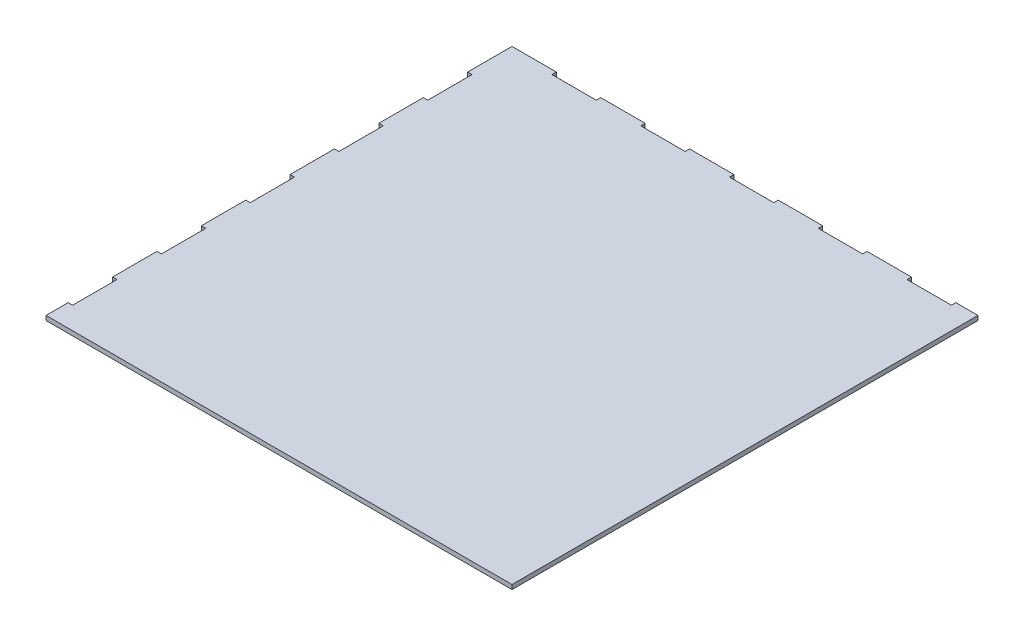
from build123d import *

# Parameters (mm, degrees)
SKETCH1_W               = 630
SKETCH1_H               = 630
BOSS_EXTRUDE1_DEPTH     = 3
SKETCH3_W               = 3
SKETCH3_H               = 30
CUT_EXTRUDE2_DEPTH      = 3
LPATTERN2_COUNT         = 10
LPATTERN2_PITCH         = 60
MIRROR1_COPY_1_SKETCH_W = 3
MIRROR1_COPY_1_SKETCH_H = 30
MIRROR1_COPY_1_DEPTH    = 3
MIRROR1_COPY_2_SKETCH_W = 3
MIRROR1_COPY_2_SKETCH_H = 30
MIRROR1_COPY_2_DEPTH    = 3
MIRROR1_COPY_3_SKETCH_W = 3
MIRROR1_COPY_3_SKETCH_H = 30
MIRROR1_COPY_3_DEPTH    = 3
MIRROR1_COPY_4_SKETCH_W = 3
MIRROR1_COPY_4_SKETCH_H = 30
MIRROR1_COPY_4_DEPTH    = 3
MIRROR1_COPY_5_SKETCH_W = 3
MIRROR1_COPY_5_SKETCH_H = 30
MIRROR1_COPY_5_DEPTH    = 3
MIRROR1_COPY_6_SKETCH_W = 3
MIRROR1_COPY_6_SKETCH_H = 30
MIRROR1_COPY_6_DEPTH    = 3
MIRROR1_COPY_7_SKETCH_W = 3
MIRROR1_COPY_7_SKETCH_H = 30
MIRROR1_COPY_7_DEPTH    = 3
MIRROR1_COPY_8_SKETCH_W = 3
MIRROR1_COPY_8_SKETCH_H = 30
MIRROR1_COPY_8_DEPTH    = 3
MIRROR1_COPY_9_SKETCH_W = 3
MIRROR1_COPY_9_SKETCH_H = 30
MIRROR1_COPY_9_DEPTH    = 3
SKETCH5_W               = 30
SKETCH5_H               = 3
CUT_EXTRUDE3_DEPTH      = 3
LPATTERN3_COUNT         = 10
LPATTERN3_PITCH         = 60
MIRROR2_COPY_1_SKETCH_W = 30
MIRROR2_COPY_1_SKETCH_H = 3
MIRROR2_COPY_1_DEPTH    = 3
MIRROR2_COPY_2_SKETCH_W = 30
MIRROR2_COPY_2_SKETCH_H = 3
MIRROR2_COPY_2_DEPTH    = 3
MIRROR2_COPY_3_SKETCH_W = 30
MIRROR2_COPY_3_SKETCH_H = 3
MIRROR2_COPY_3_DEPTH    = 3
MIRROR2_COPY_4_SKETCH_W = 30
MIRROR2_COPY_4_SKETCH_H = 3
MIRROR2_COPY_4_DEPTH    = 3
MIRROR2_COPY_5_SKETCH_W = 30
MIRROR2_COPY_5_SKETCH_H = 3
MIRROR2_COPY_5_DEPTH    = 3
MIRROR2_COPY_6_SKETCH_W = 30
MIRROR2_COPY_6_SKETCH_H = 3
MIRROR2_COPY_6_DEPTH    = 3
MIRROR2_COPY_7_SKETCH_W = 30
MIRROR2_COPY_7_SKETCH_H = 3
MIRROR2_COPY_7_DEPTH    = 3
MIRROR2_COPY_8_SKETCH_W = 30
MIRROR2_COPY_8_SKETCH_H = 3
MIRROR2_COPY_8_DEPTH    = 3
MIRROR2_COPY_9_SKETCH_W = 30
MIRROR2_COPY_9_SKETCH_H = 3
MIRROR2_COPY_9_DEPTH    = 3


with BuildPart() as part:
    # Sketch1 → Boss-Extrude1 (new body)
    with BuildSketch(Plane(origin=(0, 0, 0), x_dir=(1, 0, 0), z_dir=(0, 1, 0))):
        Rectangle(SKETCH1_W, SKETCH1_H)
    extrude(amount=BOSS_EXTRUDE1_DEPTH)

    # Sketch3 → Cut-Extrude2 (cut)
    with BuildSketch(Plane(origin=(0, 3, 0), x_dir=(1, 0, 0), z_dir=(0, 1, 0))):
        with Locations((-313.5, -270.006843512)):
            Rectangle(SKETCH3_W, SKETCH3_H)
    cut_extrude2 = extrude(amount=-CUT_EXTRUDE2_DEPTH, mode=Mode.SUBTRACT)

    # LPattern2: Cut-Extrude2 ×10
    with Locations(*[(0, 0, -i * LPATTERN2_PITCH) for i in range(1, LPATTERN2_COUNT)]):
        add(cut_extrude2, mode=Mode.SUBTRACT)

    # Mirror1: Cut-Extrude2 across plane
    add(cut_extrude2.mirror(Plane(origin=(0, 0, 0), x_dir=(0, 0, 1), z_dir=(1, 0, 0))), mode=Mode.SUBTRACT)

    # Mirror1 copy 1 sketch → Mirror1 copy 1 (cut)
    with BuildSketch(Plane(origin=(0, 3, -60), x_dir=(-1, 0, 0), z_dir=(0, 1, 0))):
        with Locations((-313.5, 270.006843512)):
            Rectangle(MIRROR1_COPY_1_SKETCH_W, MIRROR1_COPY_1_SKETCH_H)
    extrude(amount=-MIRROR1_COPY_1_DEPTH, mode=Mode.SUBTRACT)

    # Mirror1 copy 2 sketch → Mirror1 copy 2 (cut)
    with BuildSketch(Plane(origin=(0, 3, -120), x_dir=(-1, 0, 0), z_dir=(0, 1, 0))):
        with Locations((-313.5, 270.006843512)):
            Rectangle(MIRROR1_COPY_2_SKETCH_W, MIRROR1_COPY_2_SKETCH_H)
    extrude(amount=-MIRROR1_COPY_2_DEPTH, mode=Mode.SUBTRACT)

    # Mirror1 copy 3 sketch → Mirror1 copy 3 (cut)
    with BuildSketch(Plane(origin=(0, 3, -180), x_dir=(-1, 0, 0), z_dir=(0, 1, 0))):
        with Locations((-313.5, 270.006843512)):
            Rectangle(MIRROR1_COPY_3_SKETCH_W, MIRROR1_COPY_3_SKETCH_H)
    extrude(amount=-MIRROR1_COPY_3_DEPTH, mode=Mode.SUBTRACT)

    # Mirror1 copy 4 sketch → Mirror1 copy 4 (cut)
    with BuildSketch(Plane(origin=(0, 3, -240), x_dir=(-1, 0, 0), z_dir=(0, 1, 0))):
        with Locations((-313.5, 270.006843512)):
            Rectangle(MIRROR1_COPY_4_SKETCH_W, MIRROR1_COPY_4_SKETCH_H)
    extrude(amount=-MIRROR1_COPY_4_DEPTH, mode=Mode.SUBTRACT)

    # Mirror1 copy 5 sketch → Mirror1 copy 5 (cut)
    with BuildSketch(Plane(origin=(0, 3, -300), x_dir=(-1, 0, 0), z_dir=(0, 1, 0))):
        with Locations((-313.5, 270.006843512)):
            Rectangle(MIRROR1_COPY_5_SKETCH_W, MIRROR1_COPY_5_SKETCH_H)
    extrude(amount=-MIRROR1_COPY_5_DEPTH, mode=Mode.SUBTRACT)

    # Mirror1 copy 6 sketch → Mirror1 copy 6 (cut)
    with BuildSketch(Plane(origin=(0, 3, -360), x_dir=(-1, 0, 0), z_dir=(0, 1, 0))):
        with Locations((-313.5, 270.006843512)):
            Rectangle(MIRROR1_COPY_6_SKETCH_W, MIRROR1_COPY_6_SKETCH_H)
    extrude(amount=-MIRROR1_COPY_6_DEPTH, mode=Mode.SUBTRACT)

    # Mirror1 copy 7 sketch → Mirror1 copy 7 (cut)
    with BuildSketch(Plane(origin=(0, 3, -420), x_dir=(-1, 0, 0), z_dir=(0, 1, 0))):
        with Locations((-313.5, 270.006843512)):
            Rectangle(MIRROR1_COPY_7_SKETCH_W, MIRROR1_COPY_7_SKETCH_H)
    extrude(amount=-MIRROR1_COPY_7_DEPTH, mode=Mode.SUBTRACT)

    # Mirror1 copy 8 sketch → Mirror1 copy 8 (cut)
    with BuildSketch(Plane(origin=(0, 3, -480), x_dir=(-1, 0, 0), z_dir=(0, 1, 0))):
        with Locations((-313.5, 270.006843512)):
            Rectangle(MIRROR1_COPY_8_SKETCH_W, MIRROR1_COPY_8_SKETCH_H)
    extrude(amount=-MIRROR1_COPY_8_DEPTH, mode=Mode.SUBTRACT)

    # Mirror1 copy 9 sketch → Mirror1 copy 9 (cut)
    with BuildSketch(Plane(origin=(0, 3, -540), x_dir=(-1, 0, 0), z_dir=(0, 1, 0))):
        with Locations((-313.5, 270.006843512)):
            Rectangle(MIRROR1_COPY_9_SKETCH_W, MIRROR1_COPY_9_SKETCH_H)
    extrude(amount=-MIRROR1_COPY_9_DEPTH, mode=Mode.SUBTRACT)

    # Sketch5 → Cut-Extrude3 (cut)
    with BuildSketch(Plane(origin=(0, 3, 0), x_dir=(1, 0, 0), z_dir=(0, 1, 0))):
        with Locations((-270.000314512, -313.5)):
            Rectangle(SKETCH5_W, SKETCH5_H)
    cut_extrude3 = extrude(amount=-CUT_EXTRUDE3_DEPTH, mode=Mode.SUBTRACT)

    # LPattern3: Cut-Extrude3 ×10
    with Locations(*[(i * LPATTERN3_PITCH, 0, 0) for i in range(1, LPATTERN3_COUNT)]):
        add(cut_extrude3, mode=Mode.SUBTRACT)

    # Mirror2: Cut-Extrude3 across plane
    add(cut_extrude3.mirror(Plane.XY), mode=Mode.SUBTRACT)

    # Mirror2 copy 1 sketch → Mirror2 copy 1 (cut)
    with BuildSketch(Plane(origin=(60, 3, 0), x_dir=(1, 0, 0), z_dir=(0, 1, 0))):
        with Locations((-270.000314512, 313.5)):
            Rectangle(MIRROR2_COPY_1_SKETCH_W, MIRROR2_COPY_1_SKETCH_H)
    extrude(amount=-MIRROR2_COPY_1_DEPTH, mode=Mode.SUBTRACT)

    # Mirror2 copy 2 sketch → Mirror2 copy 2 (cut)
    with BuildSketch(Plane(origin=(120, 3, 0), x_dir=(1, 0, 0), z_dir=(0, 1, 0))):
        with Locations((-270.000314512, 313.5)):
            Rectangle(MIRROR2_COPY_2_SKETCH_W, MIRROR2_COPY_2_SKETCH_H)
    extrude(amount=-MIRROR2_COPY_2_DEPTH, mode=Mode.SUBTRACT)

    # Mirror2 copy 3 sketch → Mirror2 copy 3 (cut)
    with BuildSketch(Plane(origin=(180, 3, 0), x_dir=(1, 0, 0), z_dir=(0, 1, 0))):
        with Locations((-270.000314512, 313.5)):
            Rectangle(MIRROR2_COPY_3_SKETCH_W, MIRROR2_COPY_3_SKETCH_H)
    extrude(amount=-MIRROR2_COPY_3_DEPTH, mode=Mode.SUBTRACT)

    # Mirror2 copy 4 sketch → Mirror2 copy 4 (cut)
    with BuildSketch(Plane(origin=(240, 3, 0), x_dir=(1, 0, 0), z_dir=(0, 1, 0))):
        with Locations((-270.000314512, 313.5)):
            Rectangle(MIRROR2_COPY_4_SKETCH_W, MIRROR2_COPY_4_SKETCH_H)
    extrude(amount=-MIRROR2_COPY_4_DEPTH, mode=Mode.SUBTRACT)

    # Mirror2 copy 5 sketch → Mirror2 copy 5 (cut)
    with BuildSketch(Plane(origin=(300, 3, 0), x_dir=(1, 0, 0), z_dir=(0, 1, 0))):
        with Locations((-270.000314512, 313.5)):
            Rectangle(MIRROR2_COPY_5_SKETCH_W, MIRROR2_COPY_5_SKETCH_H)
    extrude(amount=-MIRROR2_COPY_5_DEPTH, mode=Mode.SUBTRACT)

    # Mirror2 copy 6 sketch → Mirror2 copy 6 (cut)
    with BuildSketch(Plane(origin=(360, 3, 0), x_dir=(1, 0, 0), z_dir=(0, 1, 0))):
        with Locations((-270.000314512, 313.5)):
            Rectangle(MIRROR2_COPY_6_SKETCH_W, MIRROR2_COPY_6_SKETCH_H)
    extrude(amount=-MIRROR2_COPY_6_DEPTH, mode=Mode.SUBTRACT)

    # Mirror2 copy 7 sketch → Mirror2 copy 7 (cut)
    with BuildSketch(Plane(origin=(420, 3, 0), x_dir=(1, 0, 0), z_dir=(0, 1, 0))):
        with Locations((-270.000314512, 313.5)):
            Rectangle(MIRROR2_COPY_7_SKETCH_W, MIRROR2_COPY_7_SKETCH_H)
    extrude(amount=-MIRROR2_COPY_7_DEPTH, mode=Mode.SUBTRACT)

    # Mirror2 copy 8 sketch → Mirror2 copy 8 (cut)
    with BuildSketch(Plane(origin=(480, 3, 0), x_dir=(1, 0, 0), z_dir=(0, 1, 0))):
        with Locations((-270.000314512, 313.5)):
            Rectangle(MIRROR2_COPY_8_SKETCH_W, MIRROR2_COPY_8_SKETCH_H)
    extrude(amount=-MIRROR2_COPY_8_DEPTH, mode=Mode.SUBTRACT)

    # Mirror2 copy 9 sketch → Mirror2 copy 9 (cut)
    with BuildSketch(Plane(origin=(540, 3, 0), x_dir=(1, 0, 0), z_dir=(0, 1, 0))):
        with Locations((-270.000314512, 313.5)):
            Rectangle(MIRROR2_COPY_9_SKETCH_W, MIRROR2_COPY_9_SKETCH_H)
    extrude(amount=-MIRROR2_COPY_9_DEPTH, mode=Mode.SUBTRACT)

    # SurfaceCut1
    split(bisect_by=Plane.XY, keep=Keep.BOTTOM)

    # SurfaceCut2
    split(bisect_by=Plane(origin=(0, 0, 0), x_dir=(0, 0, -1), z_dir=(1, 0, 0)), keep=Keep.BOTTOM)


solid = part.part
